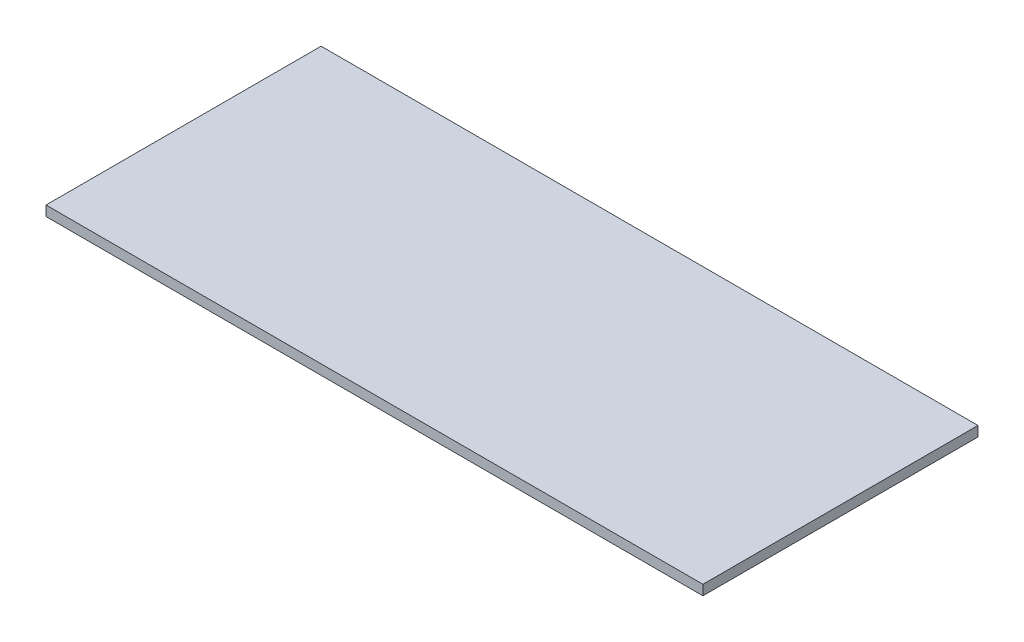
from build123d import *

# Parameters (mm, degrees)
SKETCH_1_W      = 394
SKETCH_1_H      = 165
EXTRUDE_1_DEPTH = 6


with BuildPart() as part:
    # Эскиз1 → Бобышка-Вытянуть1 (new body)
    with BuildSketch(Plane(origin=(0, 0, 0), x_dir=(1, 0, 0), z_dir=(0, 1, 0))):
        with Locations((300, 84.5)):
            Rectangle(SKETCH_1_W, SKETCH_1_H)
    extrude(amount=EXTRUDE_1_DEPTH)


solid = part.part
